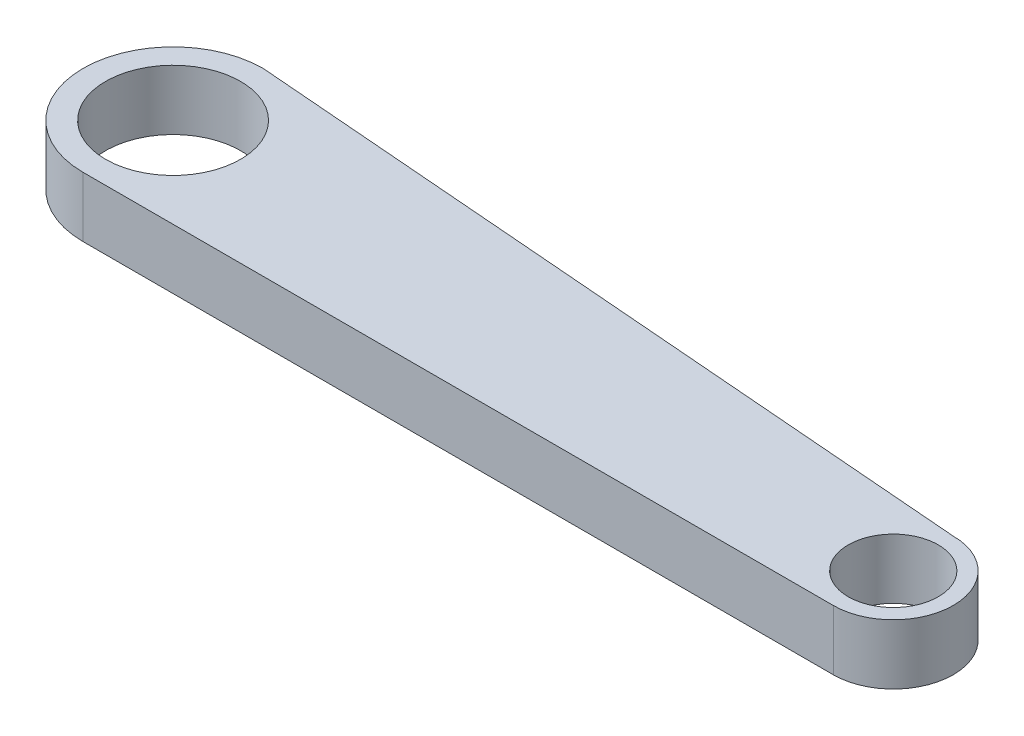
from build123d import *

# Parameters (mm, degrees)
SKETCH1_R           = 72
BOSS_EXTRUDE2_DEPTH = 64


with BuildPart() as part:
    # Sketch1 → Boss-Extrude2 (new body)
    # profile 1 of 6: a face of its own
    with BuildSketch(Plane(origin=(0, 0, 0), x_dir=(1, 0, 0), z_dir=(0, 1, 0))):
        with BuildLine():
            ThreePointArc((0, 96), (-96, 0), (0, -96))
            ThreePointArc((0, -96), (67.882250994, -67.882250994), (96, 0))
            ThreePointArc((96, 0), (73.079350127, 62.252779738), (15.262321145, 94.779014308))
            Line((15.262321145, 94.779014308), (0, 96))
        make_face()
        with Locations(Location((0, 0, 0), (0, 0, 270))):
            Circle(SKETCH1_R, mode=Mode.SUBTRACT)
    # profile 2 of 6: a face of its own
    with BuildSketch(Plane(origin=(0, 0, 0), x_dir=(1, 0, 0), z_dir=(0, 1, 0))):
        with BuildLine():
            ThreePointArc((96, 0), (67.882250994, -67.882250994), (0, -96))
            Line((0, -96), (800, -96))
            ThreePointArc((800, -96), (736, -32), (800, 32))
            Line((800, 32), (15.262321145, 94.779014308))
            ThreePointArc((15.262321145, 94.779014308), (73.079350127, 62.252779738), (96, 0))
        make_face()
    # profile 3 of 6: a face of its own
    with BuildSketch(Plane(origin=(0, 0, 0), x_dir=(1, 0, 0), z_dir=(0, 1, 0))):
        with BuildLine():
            ThreePointArc((800, 32), (736, -32), (800, -96))
            Line((800, -96), (800, -80))
            ThreePointArc((800, -80), (752, -32), (800, 16))
            Line((800, 16), (800, 32))
        make_face()
    # profile 4 of 6: a face of its own
    with BuildSketch(Plane(origin=(0, 0, 0), x_dir=(1, 0, 0), z_dir=(0, 1, 0))):
        with BuildLine():
            Line((800, -80), (800, -96))
            ThreePointArc((800, -96), (845.254833996, -77.254833996), (864, -32))
            ThreePointArc((864, -32), (845.254833996, 13.254833996), (800, 32))
            Line((800, 32), (800, 16))
            ThreePointArc((800, 16), (833.941125497, 1.941125497), (848, -32))
            ThreePointArc((848, -32), (833.941125497, -65.941125497), (800, -80))
        make_face()
    # profile 5 of 6: a face of its own
    with BuildSketch(Plane(origin=(0, 0, 0), x_dir=(1, 0, 0), z_dir=(0, 1, 0))):
        with BuildLine():
            ThreePointArc((800, 32), (736, -32), (800, -96))
            Line((800, -96), (800, -80))
            ThreePointArc((800, -80), (752, -32), (800, 16))
            Line((800, 16), (800, 32))
        make_face()
    # profile 6 of 6: a face of its own
    with BuildSketch(Plane(origin=(0, 0, 0), x_dir=(1, 0, 0), z_dir=(0, 1, 0))):
        with BuildLine():
            Line((800, -80), (800, -96))
            ThreePointArc((800, -96), (845.254833996, -77.254833996), (864, -32))
            ThreePointArc((864, -32), (845.254833996, 13.254833996), (800, 32))
            Line((800, 32), (800, 16))
            ThreePointArc((800, 16), (833.941125497, 1.941125497), (848, -32))
            ThreePointArc((848, -32), (833.941125497, -65.941125497), (800, -80))
        make_face()
    extrude(amount=BOSS_EXTRUDE2_DEPTH)


solid = part.part
